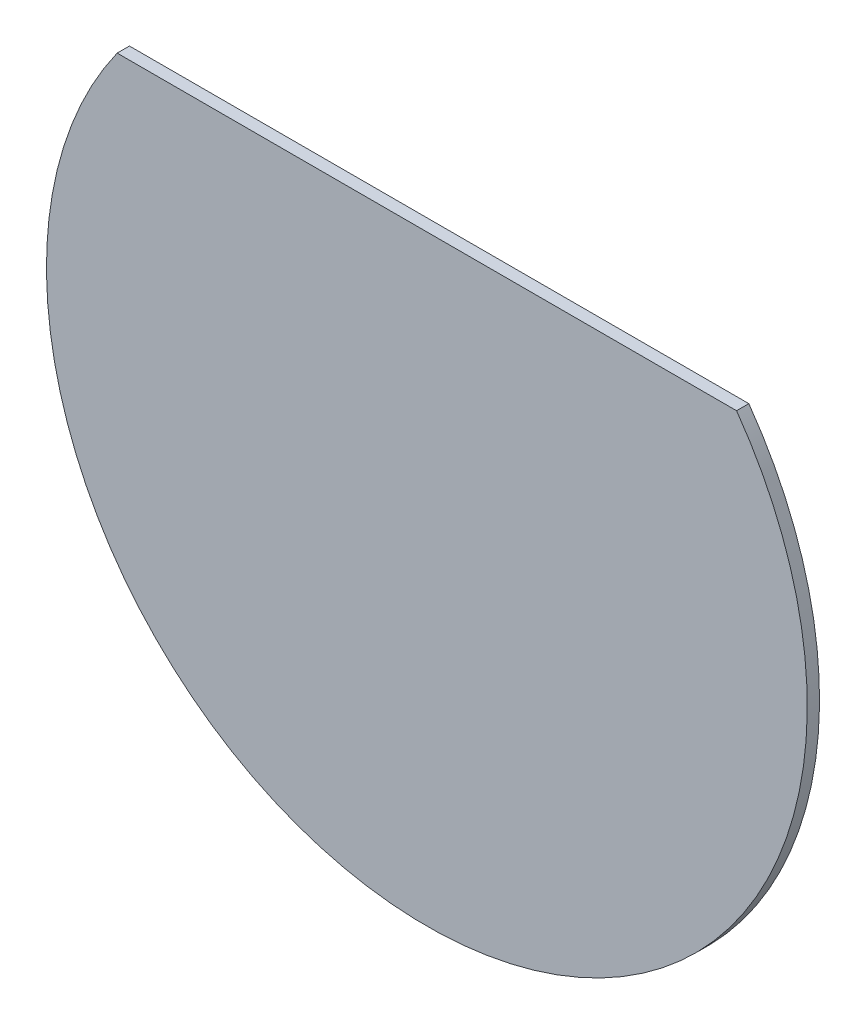
from build123d import *

# Parameters (mm, degrees)
BOSS_EXTRUDE1_DEPTH = 5


with BuildPart() as part:
    # Sketch1 → Boss-Extrude1 (new body)
    with BuildSketch(Plane.XY):
        with BuildLine():
            Line((-126.194294641, 90), (126.194294641, 90))
            ThreePointArc((126.194294641, 90), (0, -155), (-126.194294641, 90))
        make_face()
    extrude(amount=BOSS_EXTRUDE1_DEPTH)


solid = part.part
